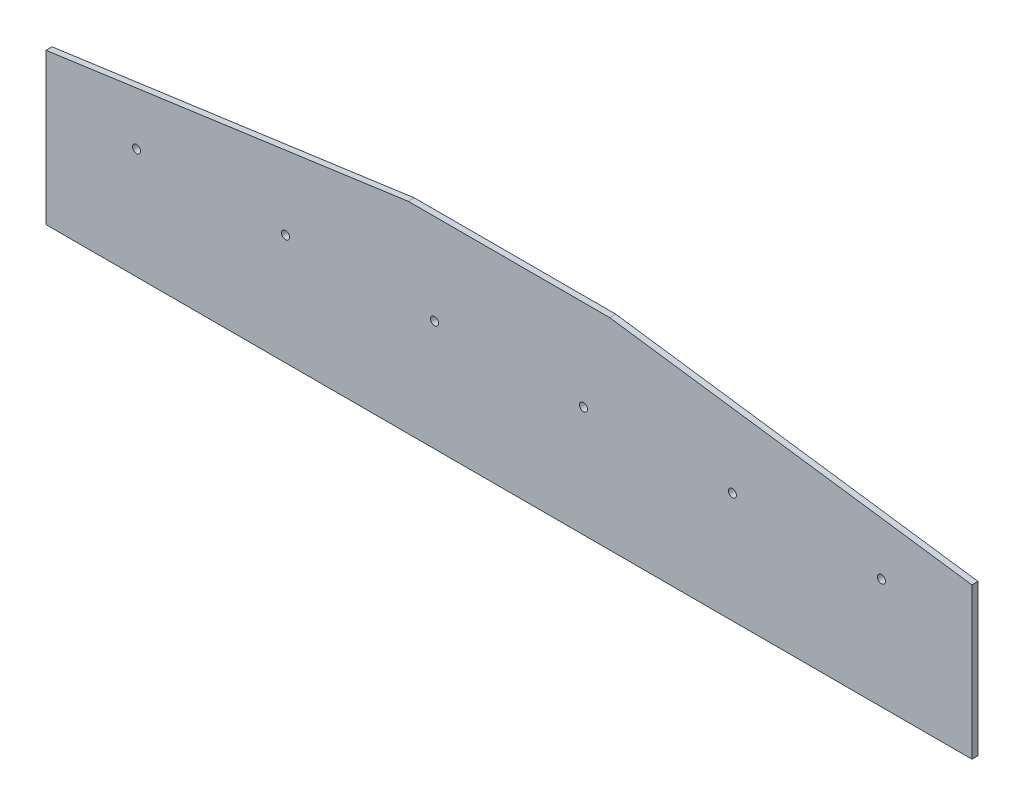
from build123d import *

# Parameters (mm, degrees)
IZIM1_R                     = 2
Y_KSEKLIK_EKSTR_ZYON1_DEPTH = 3


with BuildPart() as part:
    # Çizim1 → Yükseklik-Ekstrüzyon1 (new body)
    with BuildSketch(Plane.XY):
        Polygon((0, 0), (460, 0), (460, 75), (280, 100), (180, 100), (0, 75), align=None)
        with Locations((45, 55)):
            Circle(IZIM1_R, mode=Mode.SUBTRACT)
        with Locations((119, 55)):
            Circle(IZIM1_R, mode=Mode.SUBTRACT)
        with Locations((193, 55)):
            Circle(IZIM1_R, mode=Mode.SUBTRACT)
        with Locations((267, 55)):
            Circle(IZIM1_R, mode=Mode.SUBTRACT)
        with Locations((341, 55)):
            Circle(IZIM1_R, mode=Mode.SUBTRACT)
        with Locations((415, 55)):
            Circle(IZIM1_R, mode=Mode.SUBTRACT)
    extrude(amount=Y_KSEKLIK_EKSTR_ZYON1_DEPTH)


solid = part.part
